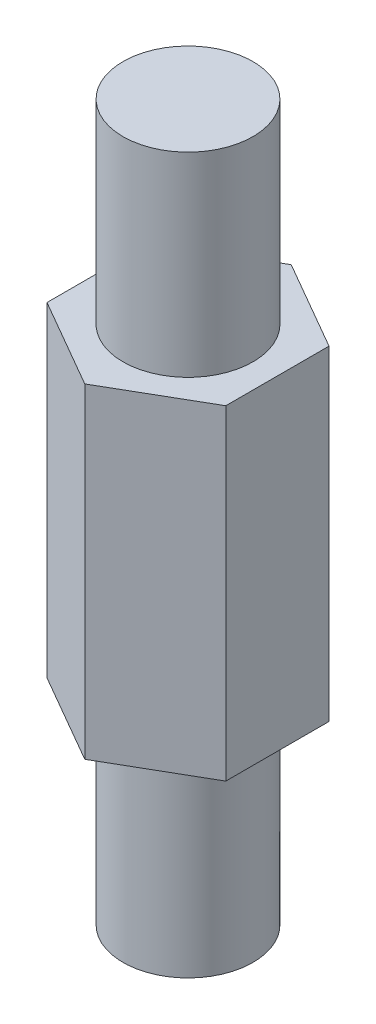
from build123d import *

# Parameters (mm, degrees)
EXTRUDE_1_DEPTH = 10
SKETCH_2_R      = 2
EXTRUDE_4_DEPTH = 6
SKETCH_3_R      = 2
EXTRUDE_5_DEPTH = 6


with BuildPart() as part:
    # Эскиз1 → Бобышка-Вытянуть1 (new body)
    with BuildSketch(Plane(origin=(0, 0, 0), x_dir=(1, 0, 0), z_dir=(0, 1, 0))):
        Polygon((0, -3.175426481), (2.75, -1.58771324), (2.75, 1.58771324), (0, 3.175426481), (-2.75, 1.58771324), (-2.75, -1.58771324), align=None)
    extrude(amount=EXTRUDE_1_DEPTH)

    # Эскиз3 → Бобышка-Вытянуть5 (add)
    with BuildSketch(Plane.XZ):
        with Locations(Location((0, 0, 0), (0, 0, 90))):
            Circle(SKETCH_3_R)
    extrude(amount=EXTRUDE_5_DEPTH)


with BuildPart() as body_2:
    # Эскиз2 → Бобышка-Вытянуть4 (new body)
    with BuildSketch(Plane(origin=(0, 10, 0), x_dir=(1, 0, 0), z_dir=(0, 1, 0))):
        with Locations(Location((0, 0, 0), (0, 0, 270))):
            Circle(SKETCH_2_R)
    extrude(amount=EXTRUDE_4_DEPTH)


solid = Compound([part.part, body_2.part])
